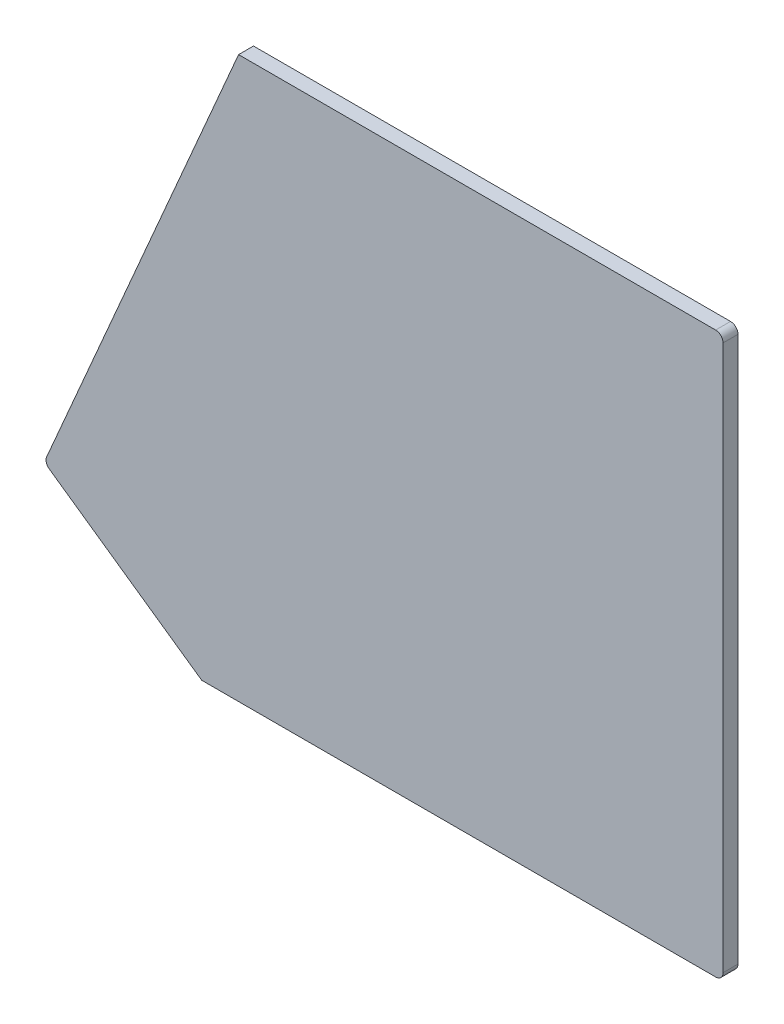
from build123d import *

# Parameters (mm, degrees)
RESSALTO_EXTRUS_O1_DEPTH = 4


with BuildPart() as part:
    # Esboço1 → Ressalto-extrusão1 (new body)
    with BuildSketch(Plane.XY):
        with BuildLine():
            Line((0, 0), (138, 0))
            ThreePointArc((138, 0), (139.414213562, 0.585786438), (140, 2))
            Line((140, 2), (140, 148.454256327))
            ThreePointArc((140, 148.454256327), (139.414213562, 149.86846989), (138, 150.454256327))
            Line((138, 150.454256327), (9.899407771, 150.454256327))
            Line((9.899407771, 150.454256327), (-41.646512669, 31.110140067))
            ThreePointArc((-41.646512669, 31.110140067), (-41.734695124, 29.77189369), (-40.957602214, 28.678821818))
            Line((-40.957602214, 28.678821818), (0, 0))
        make_face()
    extrude(amount=RESSALTO_EXTRUS_O1_DEPTH)


solid = part.part
